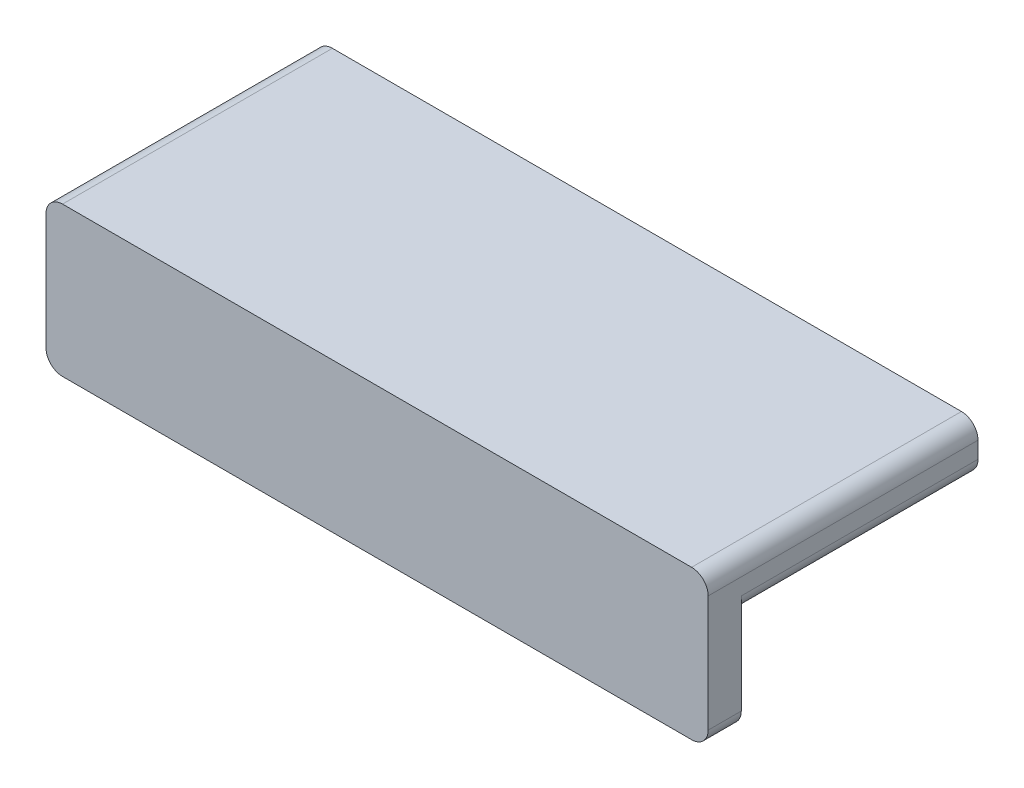
from build123d import *

# Parameters (mm, degrees)
BOSS_EXTRUDE1_DEPTH = 3.575
SKETCH3_W           = 20
SKETCH3_H           = 4.51
BOSS_EXTRUDE2_DEPTH = 1
FILLET1_R           = 0.5


with BuildPart() as part:
    # Sketch2 → Boss-Extrude1 (new, symmetric)
    with BuildSketch(Plane.XY):
        Polygon((-4.98, -2.255), (4.98, -2.255), (4.98, 0.755), (10, 0.755), (10, 2.255), (-10, 2.255), (-10, 0.755), (-4.98, 0.755), align=None)
    extrude(amount=BOSS_EXTRUDE1_DEPTH, both=True)

    # Sketch3 → Boss-Extrude2 (add)
    with BuildSketch(Plane.XY.offset(3.575)):
        Rectangle(SKETCH3_W, SKETCH3_H)
    extrude(amount=BOSS_EXTRUDE2_DEPTH)

    # Fillet1
    fillet1_edges = [part.edges().sort_by_distance(p)[0] for p in [
        (-10, 0.755, 0),
        (-10, 2.255, 0.5),
        (10, 2.255, 0.5),
        (10, 0.755, 0),
        (4.98, -2.255, 0),
        (-4.98, -2.255, 0),
        (10, -2.255, 4.075),
        (-10, -2.255, 4.075),
    ]]
    fillet(fillet1_edges, radius=FILLET1_R)


solid = part.part
